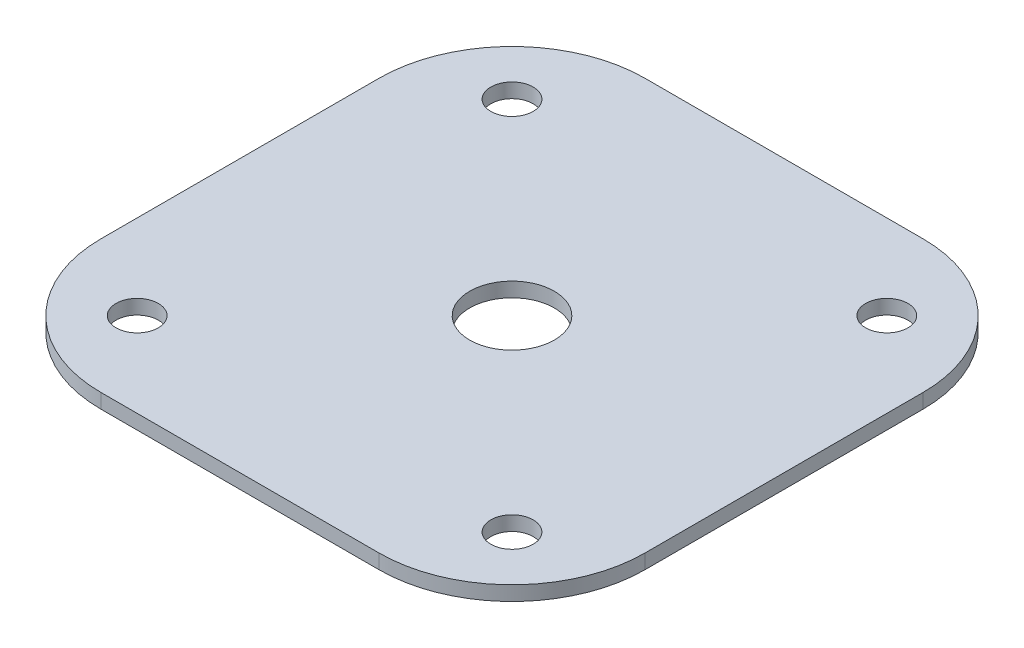
from build123d import *

# Parameters (mm, degrees)
SKETCH1_R           = 3.5
SKETCH1_R_2         = 1.75
BOSS_EXTRUDE1_DEPTH = 1.2


with BuildPart() as part:
    # Sketch1 → Boss-Extrude1 (new body)
    with BuildSketch(Plane(origin=(0, 0, 0), x_dir=(1, 0, 0), z_dir=(0, 1, 0))):
        with BuildLine():
            Line((-11.5, 22.5), (11.5, 22.5))
            ThreePointArc((11.5, 22.5), (19.278174593, 19.278174593), (22.5, 11.5))
            Line((22.5, 11.5), (22.5, -11.5))
            ThreePointArc((22.5, -11.5), (19.278174593, -19.278174593), (11.5, -22.5))
            Line((11.5, -22.5), (-11.5, -22.5))
            ThreePointArc((-11.5, -22.5), (-19.278174593, -19.278174593), (-22.5, -11.5))
            Line((-22.5, -11.5), (-22.5, 11.5))
            ThreePointArc((-22.5, 11.5), (-19.278174593, 19.278174593), (-11.5, 22.5))
        make_face()
        with Locations(Location((0, 0, 0), (0, 0, 270))):
            Circle(SKETCH1_R, mode=Mode.SUBTRACT)
        with Locations(Location((-15.5, 15.5, 0), (0, 0, 270))):
            Circle(SKETCH1_R_2, mode=Mode.SUBTRACT)
        with Locations(Location((15.5, 15.5, 0), (0, 0, 270))):
            Circle(SKETCH1_R_2, mode=Mode.SUBTRACT)
        with Locations(Location((15.5, -15.5, 0), (0, 0, 90))):
            Circle(SKETCH1_R_2, mode=Mode.SUBTRACT)
        with Locations(Location((-15.5, -15.5, 0), (0, 0, 90))):
            Circle(SKETCH1_R_2, mode=Mode.SUBTRACT)
    extrude(amount=BOSS_EXTRUDE1_DEPTH)


solid = part.part
